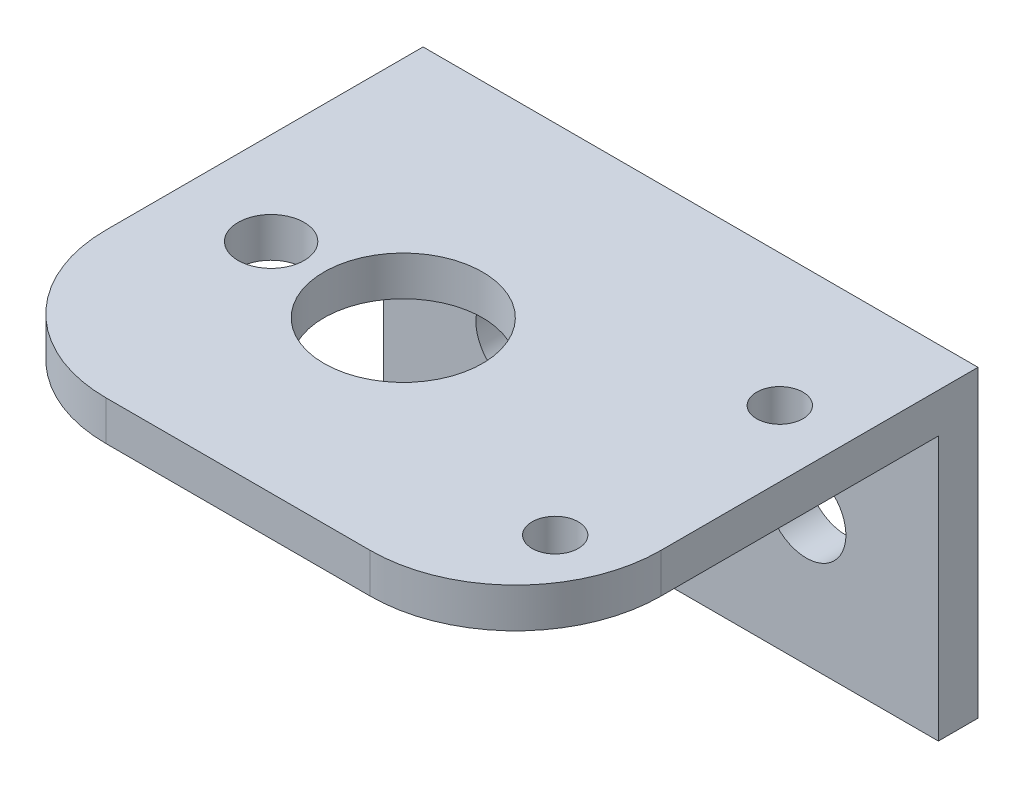
from build123d import *

# Parameters (mm, degrees)
SKETCH1_W            = 42
SKETCH1_H            = 35
SKETCH1_R            = 1.75
SKETCH1_R_2          = 6
SKETCH1_R_3          = 2.5
BOSS_EXTRUDE1_DEPTH  = 3
SKETCH2_W            = 42
SKETCH2_H            = 3
BOSS_EXTRUDE2_DEPTH  = 20
SKETCH3_R            = 3
CUT_EXTRUDE1_DEPTH   = 20
FILLET1_R            = 11
FILLET1_OF_MIRROR2_R = 11
SKETCH4_W            = 62.062681051
SKETCH4_H            = 47.471785837
CUT_EXTRUDE2_DEPTH   = 70


with BuildPart() as part:
    # Sketch1 → Boss-Extrude1 (new body)
    with BuildSketch(Plane(origin=(0, 0, 0), x_dir=(1, 0, 0), z_dir=(0, 1, 0))):
        with Locations((21, -17.5)):
            Rectangle(SKETCH1_W, SKETCH1_H)
        with Locations(Location((5, -10, 0), (0, 0, 270))):
            Circle(SKETCH1_R, mode=Mode.SUBTRACT)
        with Locations(Location((5, -27, 0), (0, 0, 270))):
            Circle(SKETCH1_R, mode=Mode.SUBTRACT)
        with Locations(Location((25, -18.5, 0), (0, 0, 270))):
            Circle(SKETCH1_R_2, mode=Mode.SUBTRACT)
        with Locations(Location((35, -18.5, 0), (0, 0, 270))):
            Circle(SKETCH1_R_3, mode=Mode.SUBTRACT)
    boss_extrude1 = extrude(amount=BOSS_EXTRUDE1_DEPTH)

    # Sketch2 → Boss-Extrude2 (add)
    with BuildSketch(Plane.XZ):
        with Locations((21, 1.5)):
            Rectangle(SKETCH2_W, SKETCH2_H)
    boss_extrude2 = extrude(amount=BOSS_EXTRUDE2_DEPTH)

    # Sketch3 → Cut-Extrude1 (cut)
    with BuildSketch(Plane(origin=(0, 0, 0), x_dir=(-1, 0, 0), z_dir=(0, 0, -1))):
        with Locations((-32, -10)):
            Circle(SKETCH3_R)
        with Locations((-10, -10)):
            Circle(SKETCH3_R)
    cut_extrude1 = extrude(amount=-CUT_EXTRUDE1_DEPTH, mode=Mode.SUBTRACT)

    # Fillet1
    fillet1_edges = [part.edges().sort_by_distance(p)[0] for p in [
        (42, 1.5, 35),
        (0, 1.5, 35),
    ]]
    fillet(fillet1_edges, radius=FILLET1_R)


with BuildPart() as mirror2_1:
    # Mirror2: Boss-Extrude1, Boss-Extrude2 across plane
    add(boss_extrude1.mirror(Plane(origin=(0, 3, 0), x_dir=(0, 0, 1), z_dir=(1, 0, 0))))
    add(boss_extrude2.mirror(Plane(origin=(0, 3, 0), x_dir=(0, 0, 1), z_dir=(1, 0, 0))))

    # Mirror2 2: Cut-Extrude1 across plane
    add(cut_extrude1.mirror(Plane(origin=(0, 3, 0), x_dir=(0, 0, 1), z_dir=(1, 0, 0))), mode=Mode.SUBTRACT)

    # Fillet1 of Mirror2
    fillet1_of_mirror2_edges = [mirror2_1.edges().sort_by_distance(p)[0] for p in [
        (-42, 1.5, 35),
        (0, 1.5, 35),
    ]]
    fillet(fillet1_of_mirror2_edges, radius=FILLET1_OF_MIRROR2_R)


with BuildPart() as part_1:
    add(part.part)

    # Mirror2 united with what the copies touc: union Mirror2_1
    add(mirror2_1.part)

    # Sketch4 → Cut-Extrude2 (cut)
    with BuildSketch(Plane.ZY):
        with Locations((16.440445312, -9.247750487)):
            Rectangle(SKETCH4_W, SKETCH4_H)
    extrude(amount=-CUT_EXTRUDE2_DEPTH, mode=Mode.SUBTRACT)


solid = part_1.part
